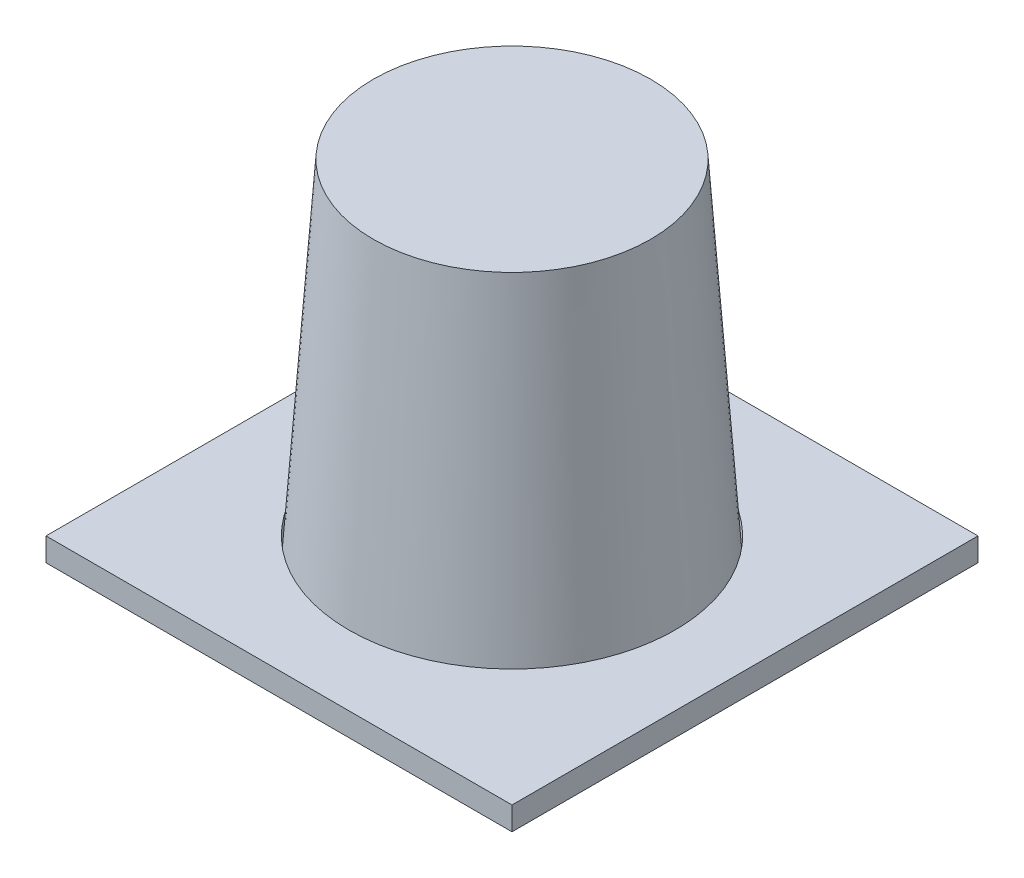
from build123d import *

# Parameters (mm, degrees)
SKETCH1_R           = 14
BOSS_EXTRUDE1_DEPTH = 30
BOSS_EXTRUDE1_TAPER = 4
SKETCH1_3_W         = 40
SKETCH1_3_H         = 40
SKETCH1_3_R         = 14
BOSS_EXTRUDE2_DEPTH = 2


with BuildPart() as part:
    # Sketch1 → Boss-Extrude1 (new body)
    with BuildSketch(Plane(origin=(0, 0, 0), x_dir=(1, 0, 0), z_dir=(0, 1, 0))):
        Circle(SKETCH1_R)
    extrude(amount=BOSS_EXTRUDE1_DEPTH, taper=BOSS_EXTRUDE1_TAPER)


with BuildPart() as body_2:
    # Sketch1<3> → Boss-Extrude2 (new body)
    with BuildSketch(Plane(origin=(0, 0, 0), x_dir=(1, 0, 0), z_dir=(0, 1, 0))):
        Rectangle(SKETCH1_3_W, SKETCH1_3_H)
        Circle(SKETCH1_3_R, mode=Mode.SUBTRACT)
    extrude(amount=BOSS_EXTRUDE2_DEPTH)


solid = Compound([part.part, body_2.part])
